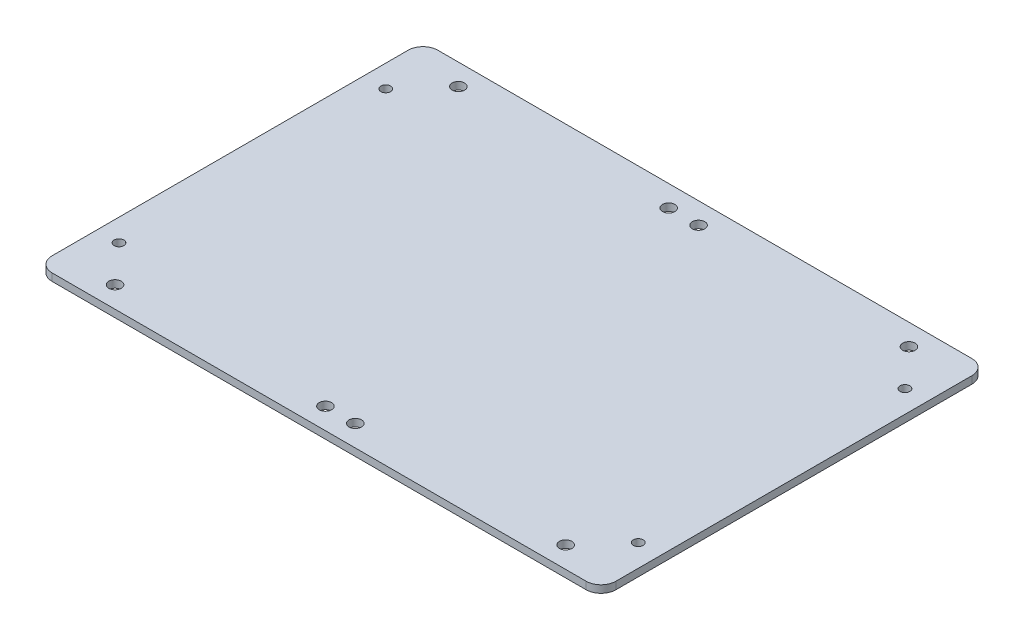
from build123d import *

# Parameters (mm, degrees)
SKETCH1_R           = 5.334
SKETCH1_R_2         = 4.191
BOSS_EXTRUDE1_DEPTH = 6.35
FILLET1_R           = 12.7


with BuildPart() as part:
    # Sketch1 → Boss-Extrude1 (new body)
    with BuildSketch(Plane(origin=(0, 0, 0), x_dir=(1, 0, 0), z_dir=(0, 1, 0))):
        Polygon((0, 0), (406.4, 0), (444.5, 0), (444.5, 330.2), (406.4, 330.2), (0, 330.2), (-38.1, 330.2), (-38.1, 0), align=None)
        with Locations(Location((10.324858278, 312.039, 0), (0, 0, 270))):
            Circle(SKETCH1_R, mode=Mode.SUBTRACT)
        with Locations(Location((10.324858278, 18.161, 0), (0, 0, 270))):
            Circle(SKETCH1_R, mode=Mode.SUBTRACT)
        with Locations(Location((190.410858278, 312.039, 0), (0, 0, 270))):
            Circle(SKETCH1_R, mode=Mode.SUBTRACT)
        with Locations(Location((190.410858278, 18.161, 0), (0, 0, 90))):
            Circle(SKETCH1_R, mode=Mode.SUBTRACT)
        with Locations(Location((215.989141722, 18.161, 0), (0, 0, 270))):
            Circle(SKETCH1_R, mode=Mode.SUBTRACT)
        with Locations(Location((396.075141722, 18.161, 0), (0, 0, 90))):
            Circle(SKETCH1_R, mode=Mode.SUBTRACT)
        with Locations(Location((215.989141722, 312.039, 0), (0, 0, 90))):
            Circle(SKETCH1_R, mode=Mode.SUBTRACT)
        with Locations(Location((396.075141722, 312.039, 0), (0, 0, 90))):
            Circle(SKETCH1_R, mode=Mode.SUBTRACT)
        with Locations(Location((-19.05, 279.273, 0), (0, 0, 270))):
            Circle(SKETCH1_R_2, mode=Mode.SUBTRACT)
        with Locations(Location((-19.05, 50.927, 0), (0, 0, 90))):
            Circle(SKETCH1_R_2, mode=Mode.SUBTRACT)
        with Locations(Location((425.45, 50.927, 0), (0, 0, 270))):
            Circle(SKETCH1_R_2, mode=Mode.SUBTRACT)
        with Locations(Location((425.45, 279.273, 0), (0, 0, 90))):
            Circle(SKETCH1_R_2, mode=Mode.SUBTRACT)
    extrude(amount=BOSS_EXTRUDE1_DEPTH)

    # Fillet1
    fillet1_edges = [part.edges().sort_by_distance(p)[0] for p in [
        (-38.1, 3.175, 0),
        (-38.1, 3.175, -330.2),
        (444.5, 3.175, -330.2),
        (444.5, 3.175, 0),
    ]]
    fillet(fillet1_edges, radius=FILLET1_R)


solid = part.part
